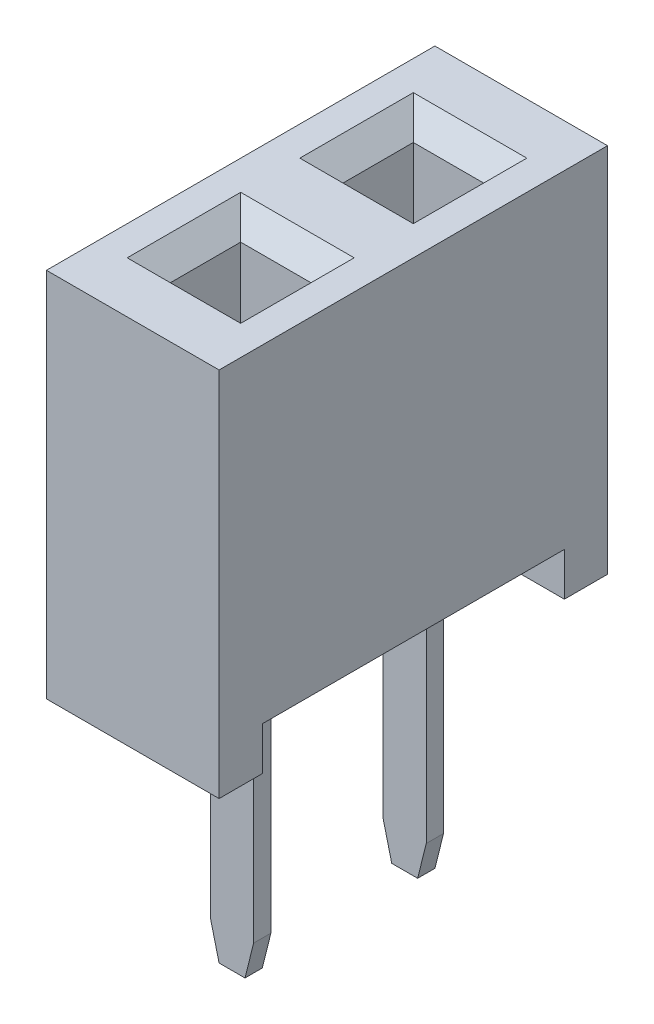
from build123d import *

# Parameters (mm, degrees)
EXTRUDE_1_DEPTH            = 1
SKETCH_3_W                 = 0.814720046
SKETCH_3_H                 = 0.814720046
CUT_EXTRUDE_1_DEPTH        = 3.5
CHAMFER_1_SIZE             = 0.25
CHAMFER_1_OF_MIRROR_1_SIZE = 0.25
EXTRUDE_2_DEPTH            = 0.25
CHAMFER_2_SIZE             = 0.1
CHAMFER_2_SIZE2            = 0.4
CUT_EXTRUDE_2_DEPTH        = 8.514818694


with BuildPart() as part:
    # 草图1 → 凸台-拉伸1 (new, symmetric)
    with BuildSketch(Plane(origin=(0, 0, 0), x_dir=(0, 0, -1), z_dir=(1, 0, 0))):
        Polygon((-2.25, 0), (2.25, 0), (2.25, -4.3), (1.75, -4.3), (1.75, -3.8), (-1.75, -3.8), (-1.75, -4.3), (-2.25, -4.3), align=None)
    extrude(amount=EXTRUDE_1_DEPTH, both=True)

    # 草图3 → 切除-拉伸1 (cut)
    with BuildSketch(Plane(origin=(0, 0, 0), x_dir=(1, 0, 0), z_dir=(0, 1, 0))):
        with Locations((0, 1)):
            Rectangle(SKETCH_3_W, SKETCH_3_H)
    cut_extrude_1 = extrude(amount=-CUT_EXTRUDE_1_DEPTH, mode=Mode.SUBTRACT)

    # 倒角1
    chamfer_1_edges = [part.edges().sort_by_distance(p)[0] for p in [
        (-0.407360023, 0, -1),
        (0, 0, -0.592639977),
        (0.407360023, 0, -1),
        (0, 0, -1.407360023),
    ]]
    chamfer(chamfer_1_edges, length=CHAMFER_1_SIZE)

    # 镜向1: 切除-拉伸1 across plane
    add(cut_extrude_1.mirror(Plane.XY), mode=Mode.SUBTRACT)

    # 倒角1 of 镜向1
    chamfer_1_of_mirror_1_edges = [part.edges().sort_by_distance(p)[0] for p in [
        (-0.407360023, 0, 1),
        (0, 0, 0.592639977),
        (0.407360023, 0, 1),
        (0, 0, 1.407360023),
    ]]
    chamfer(chamfer_1_of_mirror_1_edges, length=CHAMFER_1_OF_MIRROR_1_SIZE)

    # 草图4 → 凸台-拉伸2 (add)
    with BuildSketch(Plane(origin=(0, 0, 0), x_dir=(0, 0, -1), z_dir=(1, 0, 0))):
        Polygon((1.562968954, -3.8), (1.1, -4.088782437), (1.1, -7.1), (0.9, -7.1), (0.9, -3.977816442), (1.18507098, -3.8), align=None)
    extrude(amount=EXTRUDE_2_DEPTH)

    # 倒角2
    chamfer_2_edges = [part.edges().sort_by_distance(p)[0] for p in [
        (0.25, -7.1, -1),
    ]]
    chamfer_2_side = [part.faces().sort_by_distance(p)[0] for p in [
        (0.125, -7.1, -1),
    ]]
    chamfer(chamfer_2_edges, length=CHAMFER_2_SIZE, length2=CHAMFER_2_SIZE2, reference=chamfer_2_side[0])

    # 草图5 → 切除-拉伸2 (cut, through all)
    with BuildSketch(Plane(origin=(0, 0, 0), x_dir=(1, 0, 0), z_dir=(0, 1, 0))):
        Polygon((0, 2.25), (-1, 2.25), (-1, -2.25), (1, -2.25), (1, 0), (0, 0), align=None)
    extrude(amount=-CUT_EXTRUDE_2_DEPTH, mode=Mode.SUBTRACT)

    # 镜向3: part across plane


with BuildPart() as part_1:
    add(part.part)
    add(part.part.mirror(Plane(origin=(0, 0, 0), x_dir=(0, 0, 1), z_dir=(1, 0, 0))))

    # 镜向4: part across plane


with BuildPart() as part_2:
    add(part_1.part)
    add(part_1.part.mirror(Plane(origin=(0, -7.1, 0), x_dir=(1, 0, 0), z_dir=(0, 0, -1))))


solid = part_2.part
